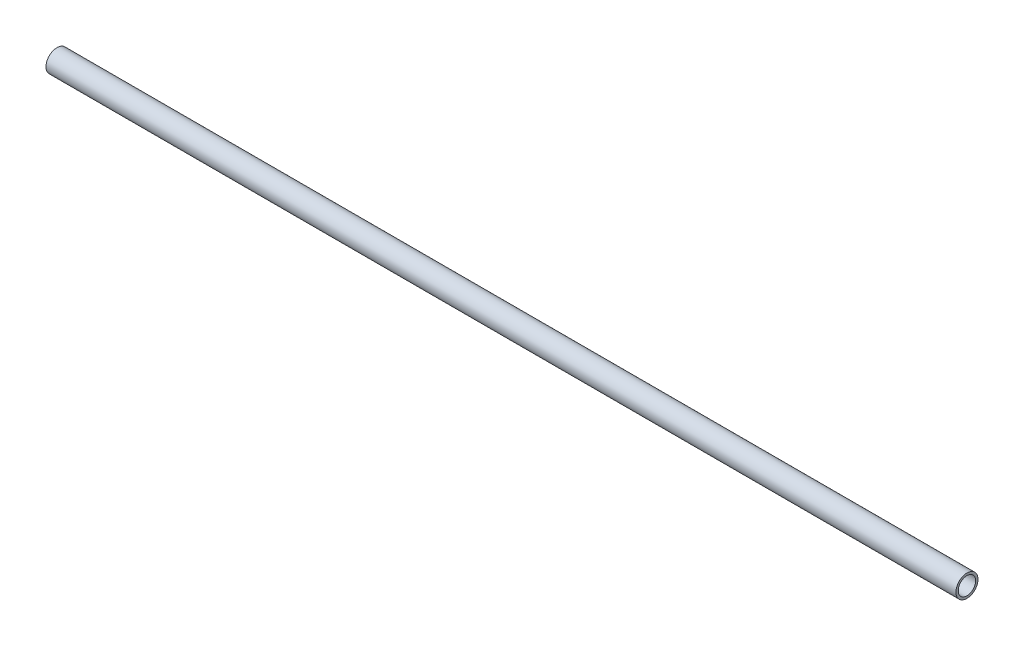
from build123d import *

# Parameters (mm, degrees)
CROQUIS1_R              = 19
CROQUIS1_R_2            = 15
SALIENTE_EXTRUIR1_DEPTH = 1565.549


with BuildPart() as part:
    # Croquis1 → Saliente-Extruir1 (new body)
    with BuildSketch(Plane(origin=(0, 0, 0), x_dir=(0, 0, -1), z_dir=(1, 0, 0))):
        Circle(CROQUIS1_R)
        Circle(CROQUIS1_R_2, mode=Mode.SUBTRACT)
    extrude(amount=SALIENTE_EXTRUIR1_DEPTH)


solid = part.part
